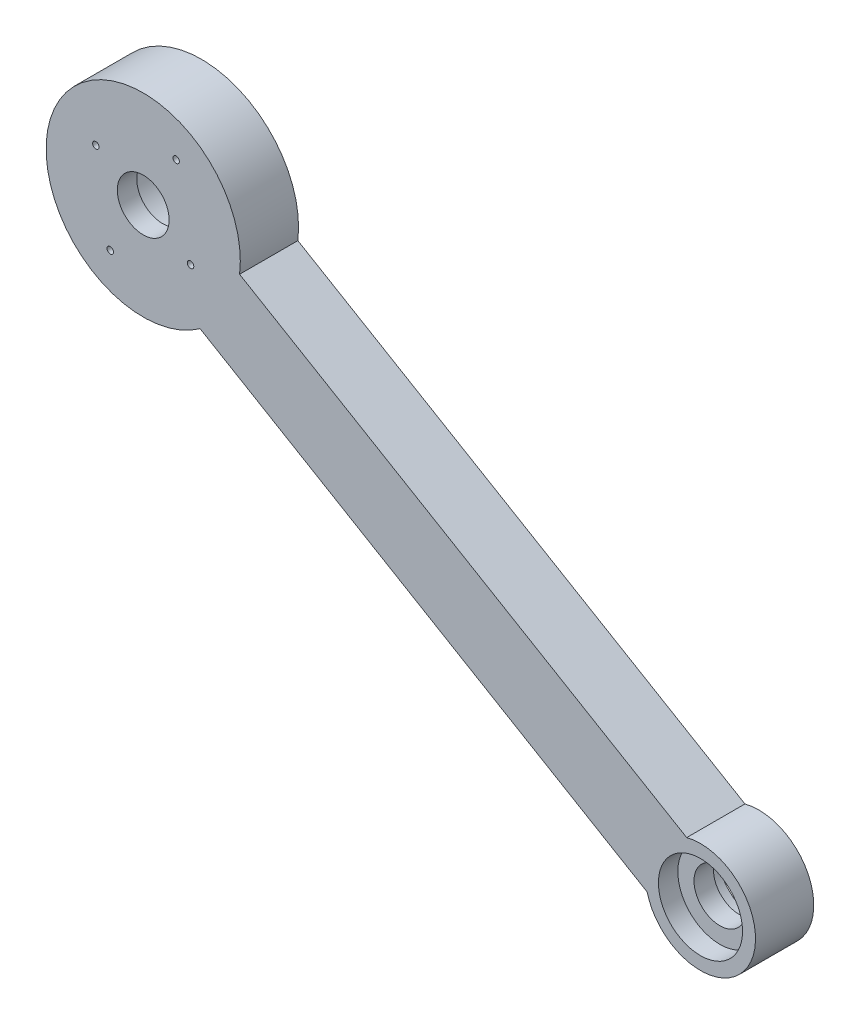
from build123d import *

# Parameters (mm, degrees)
SKETCH2_R           = 8.5
SKETCH2_R_2         = 6.5
SKETCH2_R_3         = 15
SKETCH2_R_4         = 0.5
BOSS_EXTRUDE2_DEPTH = 4.5
BOSS_EXTRUDE8_START = 1.5
SKETCH2_13_R        = 6.5
SKETCH2_13_R_2      = 4
BOSS_EXTRUDE8_DEPTH = 3
SKETCH2_7_R         = 6.5
SKETCH2_7_R_2       = 4
BOSS_EXTRUDE5_DEPTH = 1.5


with BuildPart() as part:
    # Sketch2 → Boss-Extrude2 (new, symmetric)
    # profile 1 of 3: a face of its own
    with BuildSketch(Plane(origin=(-406.338605642, -287.966071976, 0), x_dir=(-0.7121905836143565, 0.7019861626920024, 0), z_dir=(0, 0, 1))):
        with BuildLine():
            ThreePointArc((-177.488840527, -503.259500631), (-177.796019748, -505.523940447), (-178.695355275, -507.624712296))
            Line((-178.695355275, -507.624712296), (-136.02252284, -496.985180209))
            Line((-136.02252284, -496.985180209), (-100.847097363, -488.214961626))
            ThreePointArc((-100.847097363, -488.214961626), (-103.513703794, -482.696139506), (-103.75016011, -476.57141291))
            Line((-103.75016011, -476.57141291), (-138.925585587, -485.341631494))
            Line((-138.925585587, -485.341631494), (-181.598418022, -495.981163581))
            ThreePointArc((-181.598418022, -495.981163581), (-178.587199112, -499.080301623), (-177.488840527, -503.259500631))
        make_face()
    # profile 2 of 3: a face of its own
    with BuildSketch(Plane(origin=(-406.338605642, -287.966071976, 0), x_dir=(-0.7121905836143565, 0.7019861626920024, 0), z_dir=(0, 0, 1))):
        with Locations((-185.988840527, -503.259500631)):
            Circle(SKETCH2_R)
        with Locations(Location((-185.988840527, -503.259500631, 0), (0, 0, 134.586572113))):
            Circle(SKETCH2_R_2, mode=Mode.SUBTRACT)
    # profile 3 of 3: a face of its own
    with BuildSketch(Plane(origin=(-406.338605642, -287.966071976, 0), x_dir=(-0.7121905836143565, 0.7019861626920024, 0), z_dir=(0, 0, 1))):
        with Locations((-88.9592679, -479.067311072)):
            Circle(SKETCH2_R_3)
        with Locations(Location((-88.9592679, -479.067311072, 0), (0, 0, 134.586572113))):
            Circle(SKETCH2_R_2, mode=Mode.SUBTRACT)
        with Locations(Location((-80.711754227, -477.010974959, 0), (0, 0, 134.586572113))):
            Circle(SKETCH2_R_4, mode=Mode.SUBTRACT)
        with Locations(Location((-97.206781573, -481.123647184, 0), (0, 0, 134.586572113))):
            Circle(SKETCH2_R_4, mode=Mode.SUBTRACT)
        with Locations(Location((-86.540048944, -488.770268334, 0), (0, 0, 134.586572113))):
            Circle(SKETCH2_R_4, mode=Mode.SUBTRACT)
        with Locations(Location((-91.378486856, -469.364353809, 0), (0, 0, 134.586572113))):
            Circle(SKETCH2_R_4, mode=Mode.SUBTRACT)
    extrude(amount=BOSS_EXTRUDE2_DEPTH, both=True)

    # Sketch2<13> → Boss-Extrude8 (add)
    with BuildSketch(Plane(origin=(-406.338605642, -287.966071976, 0), x_dir=(-0.7121905836143565, 0.7019861626920024, 0), z_dir=(0, 0, 1)).offset(BOSS_EXTRUDE8_START)):
        with Locations(Location((-88.9592679, -479.067311072, 0), (0, 0, 134.586572113))):
            Circle(SKETCH2_13_R)
        with Locations(Location((-88.9592679, -479.067311072, 0), (0, 0, 134.586572113))):
            Circle(SKETCH2_13_R_2, mode=Mode.SUBTRACT)
    extrude(amount=BOSS_EXTRUDE8_DEPTH)

    # Sketch2<7> → Boss-Extrude5 (add, symmetric)
    with BuildSketch(Plane(origin=(-406.338605642, -287.966071976, 0), x_dir=(-0.7121905836143565, 0.7019861626920024, 0), z_dir=(0, 0, 1))):
        with Locations(Location((-185.988840527, -503.259500631, 0), (0, 0, 134.586572113))):
            Circle(SKETCH2_7_R)
        with Locations(Location((-185.988840527, -503.259500631, 0), (0, 0, 134.586572113))):
            Circle(SKETCH2_7_R_2, mode=Mode.SUBTRACT)
    extrude(amount=BOSS_EXTRUDE5_DEPTH, both=True)


solid = part.part
